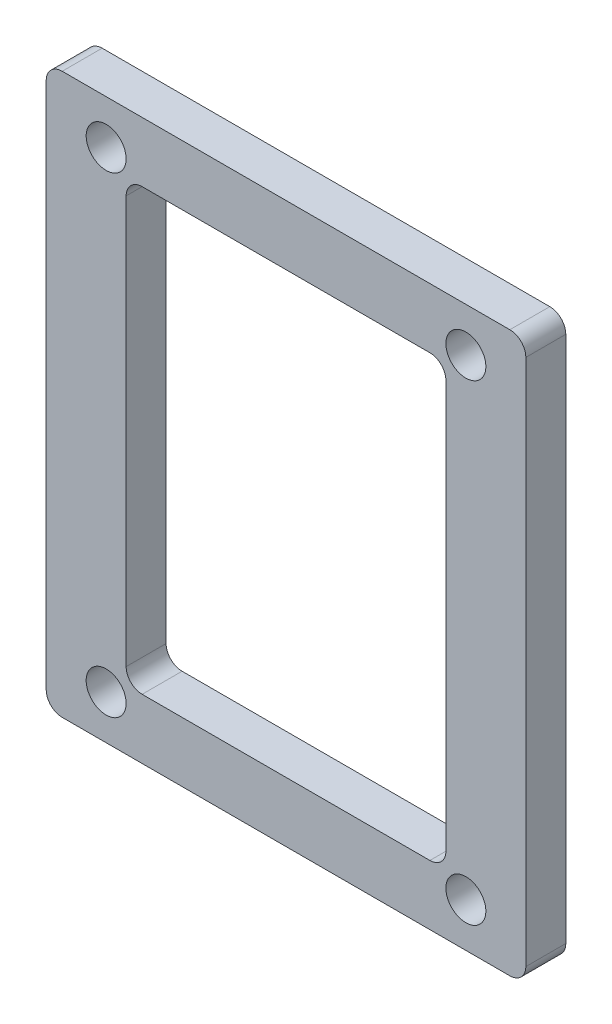
from build123d import *

# Parameters (mm, degrees)
BOSS_EXTRU_1_DEPTH      = 5
ENL_V_MAT_EXTRU_1_DEPTH = 47.368092477
ESQUISSE3_R             = 2.5
ENL_V_MAT_EXTRU_2_DEPTH = 47.368092477


with BuildPart() as part:
    # Esquisse1 → Boss.-Extru.1 (new body)
    with BuildSketch(Plane.XY):
        with BuildLine():
            Line((28, -35), (-28, -35))
            ThreePointArc((-28, -35), (-29.414213562, -34.414213562), (-30, -33))
            Line((-30, -33), (-30, 33))
            ThreePointArc((-30, 33), (-29.414213562, 34.414213562), (-28, 35))
            Line((-28, 35), (28, 35))
            ThreePointArc((28, 35), (29.414213562, 34.414213562), (30, 33))
            Line((30, 33), (30, -33))
            ThreePointArc((30, -33), (29.414213562, -34.414213562), (28, -35))
        make_face()
    extrude(amount=BOSS_EXTRU_1_DEPTH)

    # Esquisse2 → Enlèv. mat.-Extru.1 (cut, through all)
    with BuildSketch(Plane(origin=(0, 0, 0), x_dir=(-1, 0, 0), z_dir=(0, 0, -1))):
        with BuildLine():
            Line((18, -27.5), (-18, -27.5))
            ThreePointArc((-18, -27.5), (-19.414213562, -26.914213562), (-20, -25.5))
            Line((-20, -25.5), (-20, 25.5))
            ThreePointArc((-20, 25.5), (-19.414213562, 26.914213562), (-18, 27.5))
            Line((-18, 27.5), (18, 27.5))
            ThreePointArc((18, 27.5), (19.414213562, 26.914213562), (20, 25.5))
            Line((20, 25.5), (20, -25.5))
            ThreePointArc((20, -25.5), (19.414213562, -26.914213562), (18, -27.5))
        make_face()
    extrude(amount=-ENL_V_MAT_EXTRU_1_DEPTH, mode=Mode.SUBTRACT)

    # Esquisse3 → Enlèv. mat.-Extru.2 (cut, through all)
    with BuildSketch(Plane.XY.offset(5)):
        with Locations((-22.5, -29.5)):
            Circle(ESQUISSE3_R)
        with Locations((22.5, -29.5)):
            Circle(ESQUISSE3_R)
        with Locations((-22.5, 29.5)):
            Circle(ESQUISSE3_R)
        with Locations((22.5, 29.5)):
            Circle(ESQUISSE3_R)
    extrude(amount=-ENL_V_MAT_EXTRU_2_DEPTH, mode=Mode.SUBTRACT)


solid = part.part
